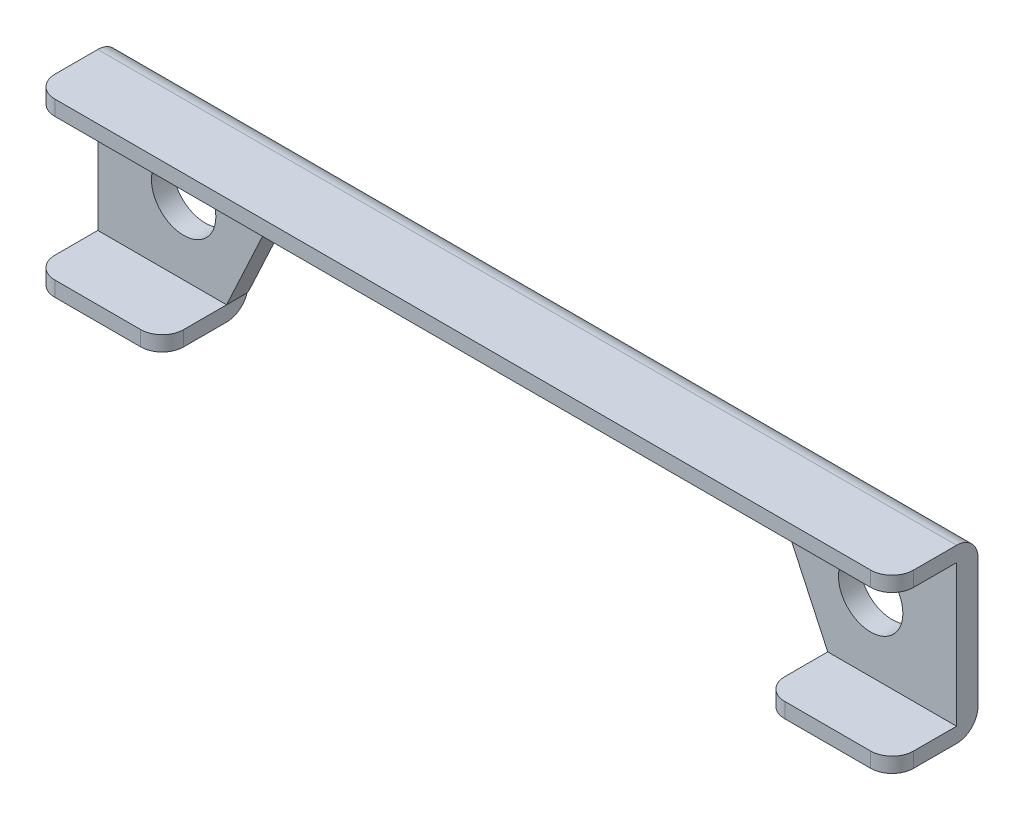
from build123d import *

# Parameters (mm, degrees)
SKETCH1_W           = 40
SKETCH1_H           = 8
BOSS_EXTRUDE1_DEPTH = 1
SKETCH2_W           = 6
SKETCH2_H           = 0.7
BOSS_EXTRUDE2_DEPTH = 3
SKETCH3_W           = 40
SKETCH3_H           = 0.7
BOSS_EXTRUDE3_DEPTH = 3
CUT_EXTRUDE2_DEPTH  = 3
SKETCH5_R           = 1.5
CUT_EXTRUDE3_DEPTH  = 3
FILLET1_R           = 1


with BuildPart() as part:
    # Sketch1 → Boss-Extrude1 (new body)
    with BuildSketch(Plane.XY):
        Rectangle(SKETCH1_W, SKETCH1_H)
    extrude(amount=BOSS_EXTRUDE1_DEPTH)

    # Sketch2 → Boss-Extrude2 (add)
    with BuildSketch(Plane.XY.offset(1)):
        with Locations((-17, -3.65)):
            Rectangle(SKETCH2_W, SKETCH2_H)
        with Locations((17, -3.65)):
            Rectangle(SKETCH2_W, SKETCH2_H)
    extrude(amount=BOSS_EXTRUDE2_DEPTH)

    # Sketch3 → Boss-Extrude3 (add)
    with BuildSketch(Plane.XY.offset(1)):
        with Locations((0, 3.65)):
            Rectangle(SKETCH3_W, SKETCH3_H)
    extrude(amount=BOSS_EXTRUDE3_DEPTH)

    # Sketch4 → Cut-Extrude2 (cut)
    with BuildSketch(Plane.XY.offset(1)):
        Polygon((-12, 1), (12, 1), (14, -3.3), (14, -4), (-14, -4), (-14, -3.3), align=None)
    extrude(amount=-CUT_EXTRUDE2_DEPTH, mode=Mode.SUBTRACT)

    # Sketch5 → Cut-Extrude3 (cut)
    with BuildSketch(Plane.XY.offset(1)):
        with Locations((16, 0)):
            Circle(SKETCH5_R)
        with Locations((-16, 0)):
            Circle(SKETCH5_R)
    extrude(amount=-CUT_EXTRUDE3_DEPTH, mode=Mode.SUBTRACT)

    # Fillet1
    fillet1_edges = [part.edges().sort_by_distance(p)[0] for p in [
        (-14, -3.65, 4),
        (-20, -3.65, 4),
        (14, -3.65, 4),
        (20, -3.65, 4),
        (20, 3.65, 4),
        (-20, 3.65, 4),
        (17, -4, 0),
        (-17, -4, 0),
        (0, 4, 0),
    ]]
    fillet(fillet1_edges, radius=FILLET1_R)


solid = part.part
